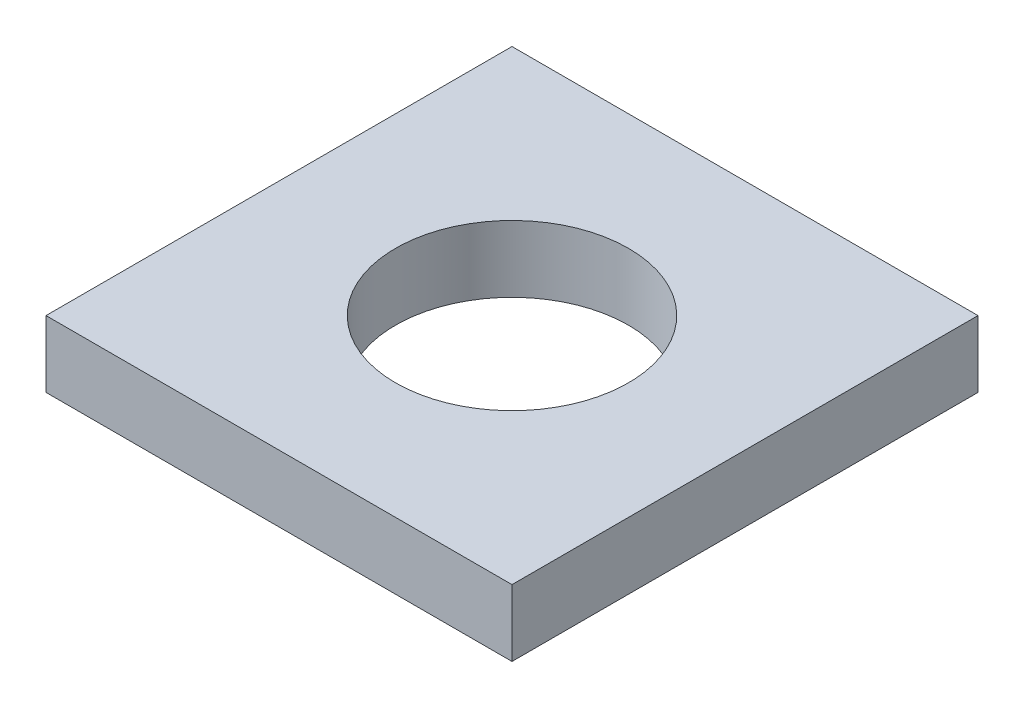
from build123d import *

# Parameters (mm, degrees)
SKETCH_1_W      = 7
SKETCH_1_H      = 7
SKETCH_1_R      = 1.75
EXTRUDE_1_DEPTH = 1


with BuildPart() as part:
    # 草图1 → 凸台-拉伸1 (new body)
    with BuildSketch(Plane(origin=(0, 0, 0), x_dir=(1, 0, 0), z_dir=(0, 1, 0))):
        Rectangle(SKETCH_1_W, SKETCH_1_H)
        with Locations(Location((0, 0, 0), (0, 0, 270))):
            Circle(SKETCH_1_R, mode=Mode.SUBTRACT)
    extrude(amount=EXTRUDE_1_DEPTH)


solid = part.part
